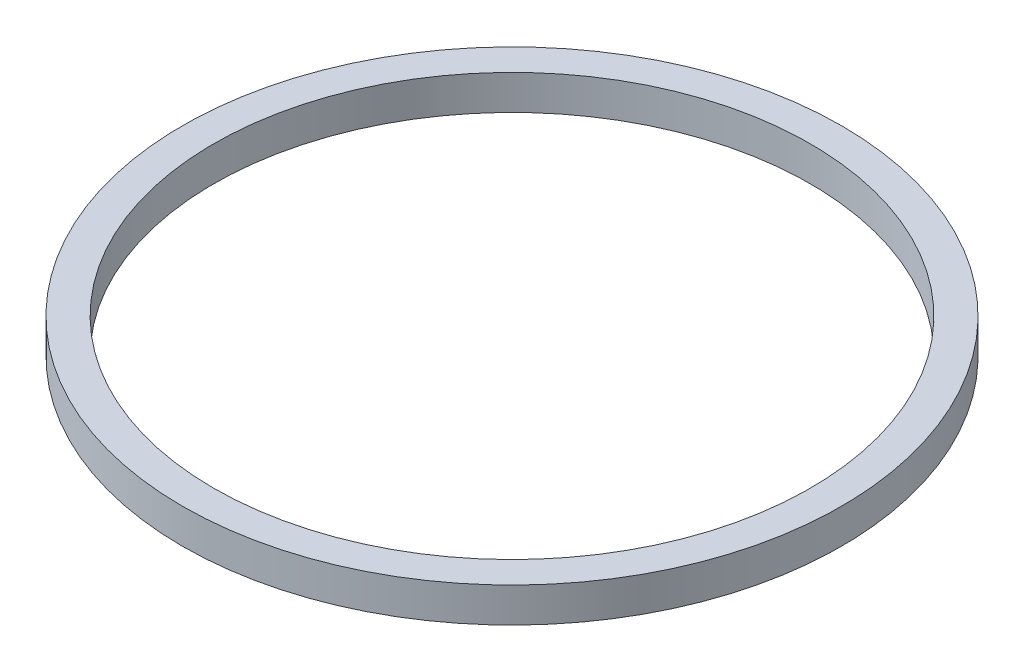
from build123d import *

# Parameters (mm, degrees)
SKETCH_1_R      = 9.5
SKETCH_1_R_2    = 8.6
EXTRUDE_1_DEPTH = 1


with BuildPart() as part:
    # 草图1 → 凸台-拉伸1 (new body)
    with BuildSketch(Plane(origin=(0, 0, 0), x_dir=(1, 0, 0), z_dir=(0, 1, 0))):
        with Locations(Location((0, 0, 0), (0, 0, 270))):
            Circle(SKETCH_1_R)
        with Locations(Location((0, 0, 0), (0, 0, 270))):
            Circle(SKETCH_1_R_2, mode=Mode.SUBTRACT)
    extrude(amount=EXTRUDE_1_DEPTH)


solid = part.part
